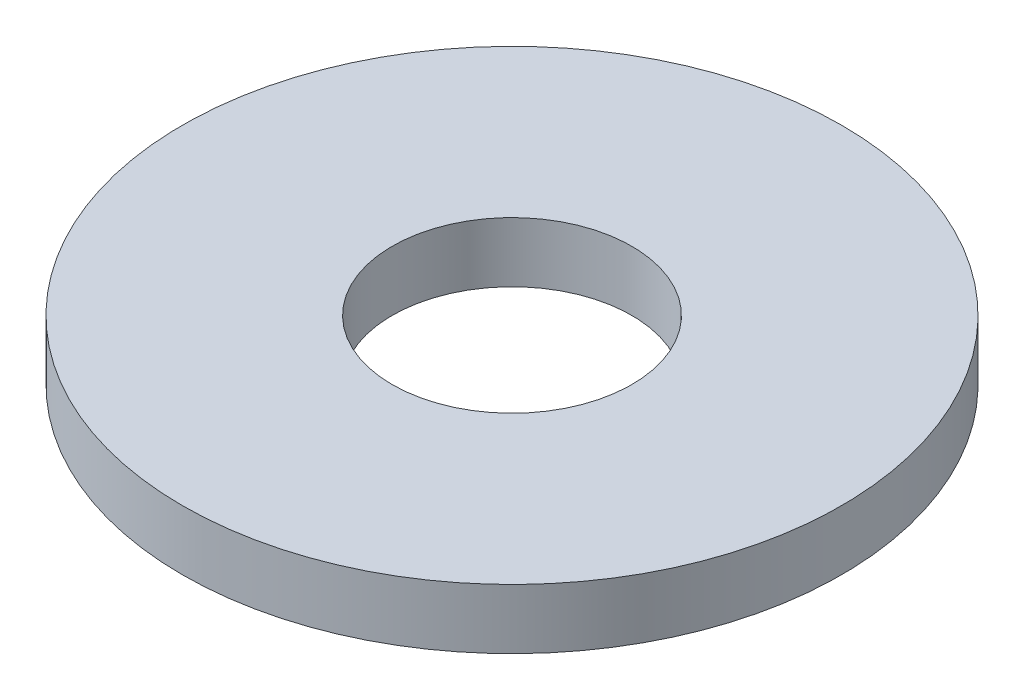
from build123d import *

# Parameters (mm, degrees)
SKETCH1_R           = 17.4625
SKETCH1_R_2         = 6.35
BOSS_EXTRUDE1_DEPTH = 3.175


with BuildPart() as part:
    # Sketch1 → Boss-Extrude1 (new body)
    with BuildSketch(Plane(origin=(0, 0, 0), x_dir=(1, 0, 0), z_dir=(0, 1, 0))):
        with Locations(Location((0, 0, 0), (0, 0, 270))):
            Circle(SKETCH1_R)
        with Locations(Location((0, 0, 0), (0, 0, 270))):
            Circle(SKETCH1_R_2, mode=Mode.SUBTRACT)
    extrude(amount=BOSS_EXTRUDE1_DEPTH)


solid = part.part
